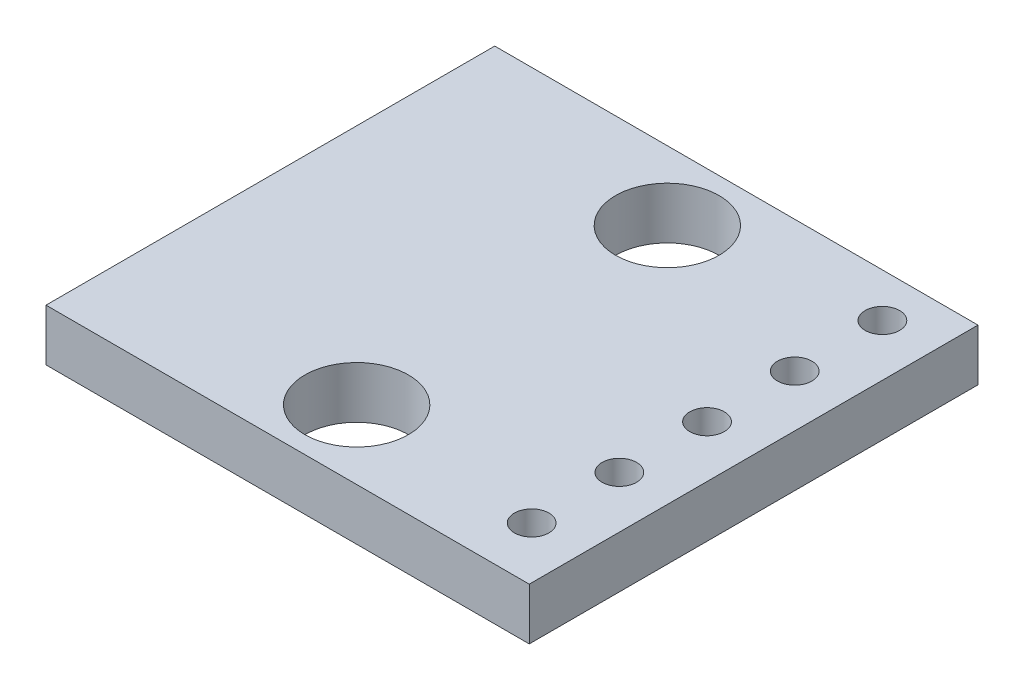
from build123d import *

# Parameters (mm, degrees)
SKETCH1_W           = 14
SKETCH1_H           = 13
BOSS_EXTRUDE1_DEPTH = 1.5
SKETCH2_R           = 1.5
SKETCH2_R_2         = 0.5
CUT_EXTRUDE1_DEPTH  = 1.5


with BuildPart() as part:
    # Sketch1 → Boss-Extrude1 (new body)
    with BuildSketch(Plane(origin=(0, 0, 0), x_dir=(1, 0, 0), z_dir=(0, 1, 0))):
        Rectangle(SKETCH1_W, SKETCH1_H)
    extrude(amount=BOSS_EXTRUDE1_DEPTH)

    # Sketch2 → Cut-Extrude1 (cut)
    with BuildSketch(Plane(origin=(0, 1.5, 0), x_dir=(1, 0, 0), z_dir=(0, 1, 0))):
        with Locations(Location((0, 4.5, 0), (0, 0, 270))):
            Circle(SKETCH2_R)
        with Locations(Location((0, -4.5, 0), (0, 0, 270))):
            Circle(SKETCH2_R)
        with Locations(Location((5.5, -4.93, 0), (0, 0, 270))):
            Circle(SKETCH2_R_2)
        with Locations(Location((5.5, -2.39, 0), (0, 0, 270))):
            Circle(SKETCH2_R_2)
        with Locations(Location((5.5, 0.15, 0), (0, 0, 270))):
            Circle(SKETCH2_R_2)
        with Locations(Location((5.5, 2.69, 0), (0, 0, 270))):
            Circle(SKETCH2_R_2)
        with Locations(Location((5.5, 5.23, 0), (0, 0, 270))):
            Circle(SKETCH2_R_2)
    extrude(amount=-CUT_EXTRUDE1_DEPTH, mode=Mode.SUBTRACT)


solid = part.part
